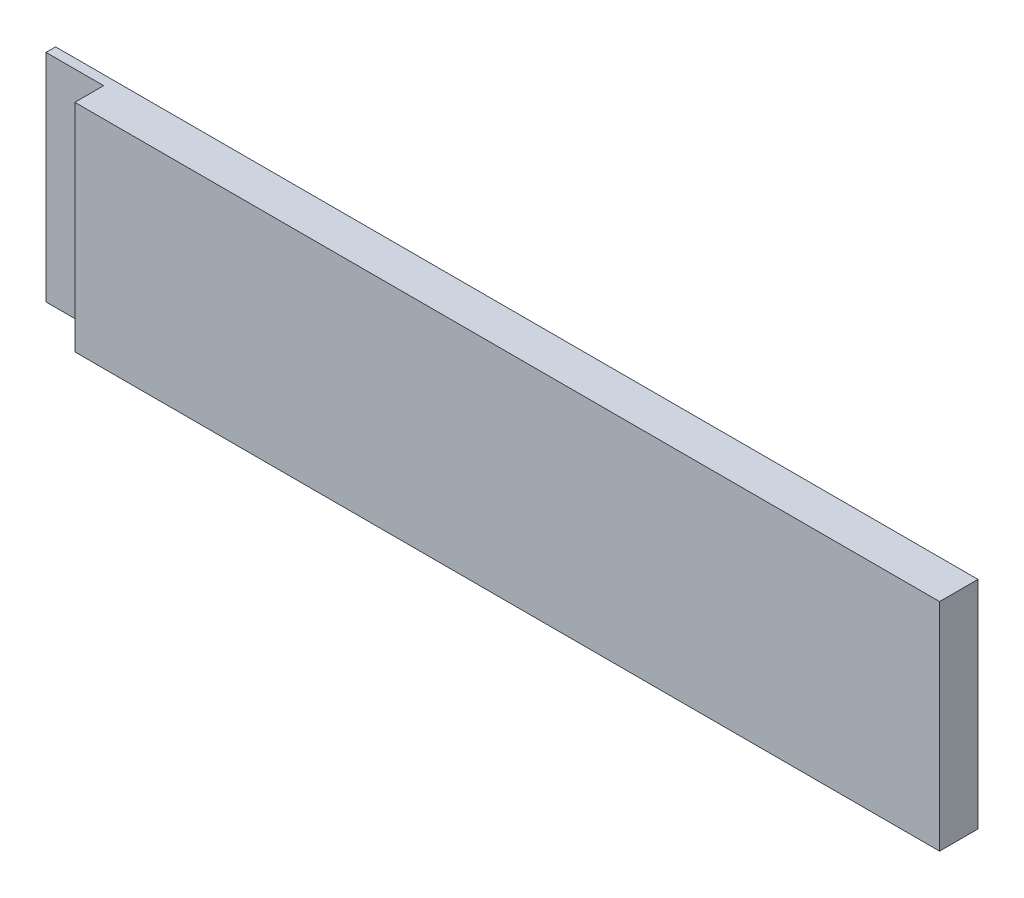
from build123d import *

# Parameters (mm, degrees)
SKETCH1_W           = 304.8
SKETCH1_H           = 71.4248
BOSS_EXTRUDE1_DEPTH = 12.7
SKETCH2_W           = 19.05
SKETCH2_H           = 71.4248
CUT_EXTRUDE1_DEPTH  = 9.525


with BuildPart() as part:
    # Sketch1 → Boss-Extrude1 (new body)
    with BuildSketch(Plane.XY):
        Rectangle(SKETCH1_W, SKETCH1_H)
    extrude(amount=BOSS_EXTRUDE1_DEPTH)

    # Sketch2 → Cut-Extrude1 (cut)
    with BuildSketch(Plane.XY.offset(12.7)):
        with Locations((-142.875, 0)):
            Rectangle(SKETCH2_W, SKETCH2_H)
    extrude(amount=-CUT_EXTRUDE1_DEPTH, mode=Mode.SUBTRACT)


solid = part.part
